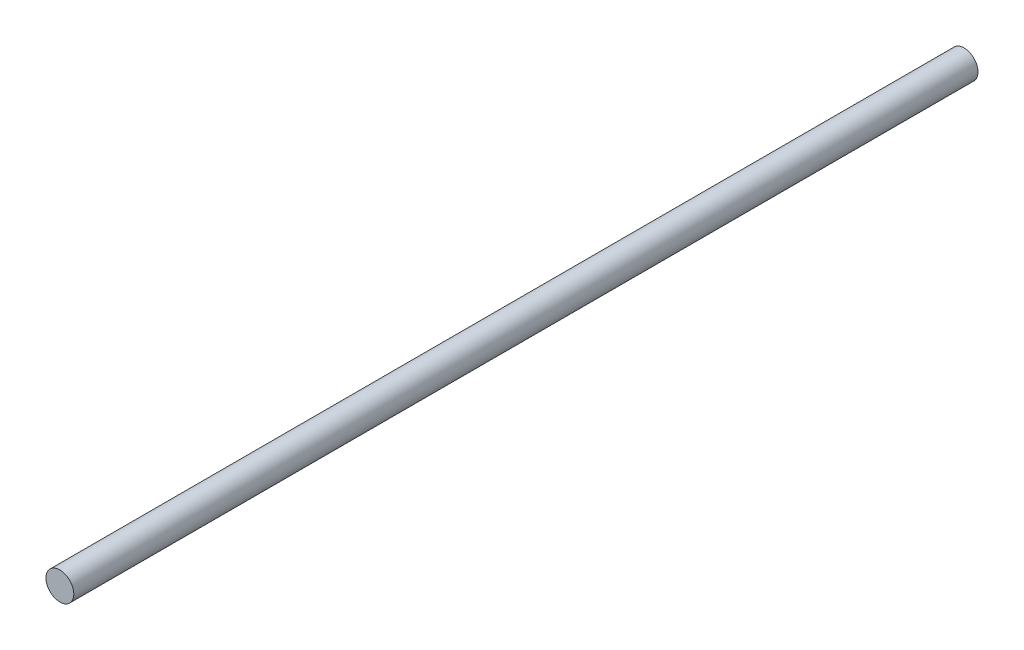
from build123d import *

# Parameters (mm, degrees)
SKETCH1_R           = 4
BOSS_EXTRUDE1_DEPTH = 260


with BuildPart() as part:
    # Sketch1 → Boss-Extrude1 (new body)
    with BuildSketch(Plane.XY):
        Circle(SKETCH1_R)
    extrude(amount=BOSS_EXTRUDE1_DEPTH)


solid = part.part
